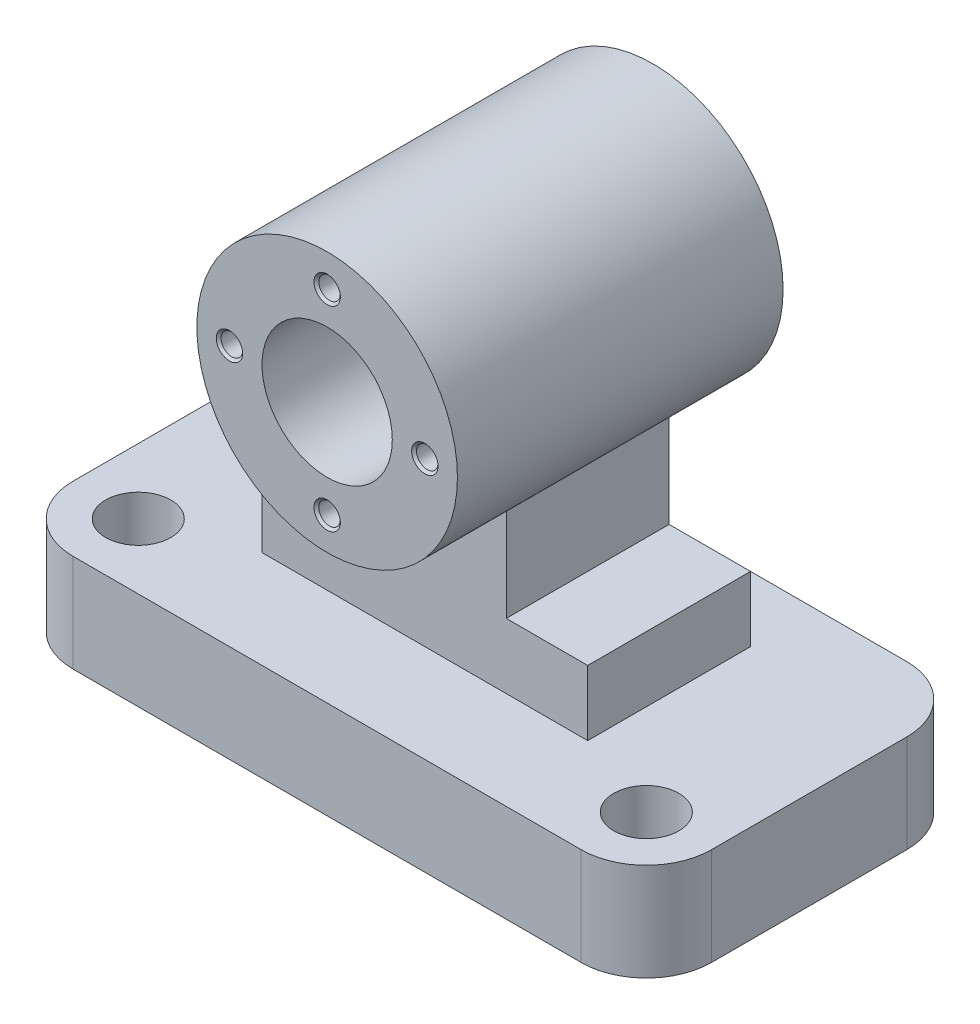
from build123d import *

# Parameters (mm, degrees)
SKETCH_1_W                   = 98
SKETCH_1_H                   = 15
EXTRUDE_1_DEPTH              = 50
SKETCH_2_R                   = 20
SKETCH_2_R_2                 = 10
EXTRUDE_2_DEPTH              = 50
SKETCH_4_W                   = 25
SKETCH_4_H                   = 24.3455958
EXTRUDE_3_DEPTH              = 12.5
FILLET_1_R                   = 10
SKETCH_7_R                   = 5
CUT_EXTRUDE_1_DEPTH          = 25
HOLE_WIZARD_M4_1_D           = 3.3
HOLE_WIZARD_M4_1_CSINK_D     = 4.05
HOLE_WIZARD_M4_1_CSINK_ANGLE = 92
SKETCH_12_W                  = 50
SKETCH_12_H                  = 10
EXTRUDE_4_DEPTH              = 25


with BuildPart() as part:
    # 스케치1 → 보스-돌출1 (new body)
    with BuildSketch(Plane.XY):
        with Locations((0, -27.507396928)):
            Rectangle(SKETCH_1_W, SKETCH_1_H)
    extrude(amount=EXTRUDE_1_DEPTH)



with BuildPart() as body_2:
    # 스케치2 → 보스-돌출2 (new body)
    with BuildSketch(Plane.XY.offset(50)):
        with Locations((0, 19.992603072)):
            Circle(SKETCH_2_R)
        with Locations((0, 19.992603072)):
            Circle(SKETCH_2_R_2, mode=Mode.SUBTRACT)
    extrude(amount=-EXTRUDE_2_DEPTH)


with BuildPart() as part_1:
    add(part.part)

    add(body_2.part)  # 보스-돌출3 merges body 2
    # 스케치4 → 보스-돌출3 (add, symmetric)
    with BuildSketch(Plane(origin=(0, 0, 0), x_dir=(0, 0, -1), z_dir=(1, 0, 0))):
        with Locations((-22.5, -7.834599028)):
            Rectangle(SKETCH_4_W, SKETCH_4_H)
    extrude(amount=EXTRUDE_3_DEPTH, both=True)

    # 필렛1
    fillet_1_edges = [part_1.edges().sort_by_distance(p)[0] for p in [
        (-49, -27.507396928, 50),
        (49, -27.507396928, 50),
        (-49, -27.507396928, 0),
        (49, -27.507396928, 0),
    ]]
    fillet(fillet_1_edges, radius=FILLET_1_R)

    # 스케치7 → 컷-돌출1 (cut)
    with BuildSketch(Plane(origin=(0, -20.007396928, 0), x_dir=(1, 0, 0), z_dir=(0, 1, 0))):
        with Locations(Location((-39, -40, 0), (0, 0, 270))):
            Circle(SKETCH_7_R)
        with Locations(Location((39, -40, 0), (0, 0, 270))):
            Circle(SKETCH_7_R)
    extrude(amount=-CUT_EXTRUDE_1_DEPTH, mode=Mode.SUBTRACT)

    # M4 나사 구멍1 (through all)
    with Locations(Plane(origin=(0, 34.992603072, 50), x_dir=(1, 0, 0), z_dir=(0, 0, 1))):
        with Locations((0, 0), (-15, -15), (15, -15), (0, -30)):
            CounterSinkHole(HOLE_WIZARD_M4_1_D / 2, HOLE_WIZARD_M4_1_CSINK_D / 2, counter_sink_angle=HOLE_WIZARD_M4_1_CSINK_ANGLE)

    # 스케치12 → 보스-돌출4 (add)
    with BuildSketch(Plane.XY.offset(35)):
        with Locations((0, -15.007396928)):
            Rectangle(SKETCH_12_W, SKETCH_12_H)
    extrude(amount=-EXTRUDE_4_DEPTH)


solid = part_1.part
